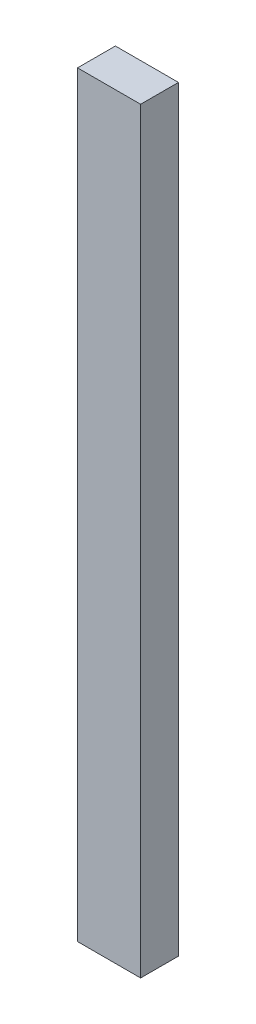
from build123d import *

# Parameters (mm, degrees)
ESBO_O1_W                = 10
ESBO_O1_H                = 120
RESSALTO_EXTRUS_O1_DEPTH = 6


with BuildPart() as part:
    # Esboço1 → Ressalto-extrusão1 (new body)
    with BuildSketch(Plane.XY):
        with Locations((-1.603444994, 60)):
            Rectangle(ESBO_O1_W, ESBO_O1_H)
    extrude(amount=RESSALTO_EXTRUS_O1_DEPTH)


solid = part.part
